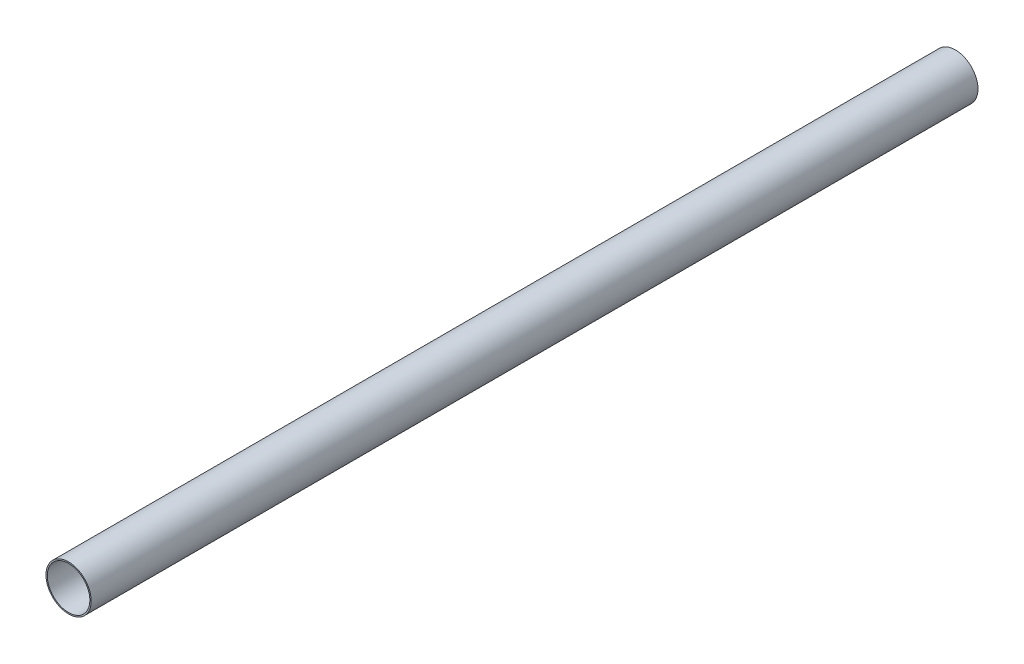
from build123d import *

# Parameters (mm, degrees)
SKETCH_1_R      = 25.5
SKETCH_1_R_2    = 24
EXTRUDE_1_DEPTH = 500


with BuildPart() as part:
    # Эскиз1 → Бобышка-Вытянуть1 (new, symmetric)
    with BuildSketch(Plane.XY):
        Circle(SKETCH_1_R)
        Circle(SKETCH_1_R_2, mode=Mode.SUBTRACT)
    extrude(amount=EXTRUDE_1_DEPTH, both=True)


solid = part.part
